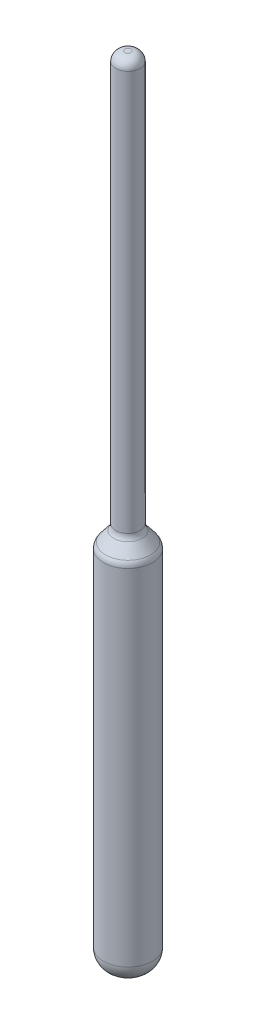
from build123d import *

# Parameters (mm, degrees)
FILLET1_R = 3
FILLET2_R = 3
FILLET3_R = 3
FILLET4_R = 6


with BuildPart() as part:
    # Sketch1 → Revolve1 (revolve)
    with BuildSketch(Plane.XY, mode=Mode.PRIVATE) as revolve1_sk:
        Polygon((0, 0), (0, 260), (-4, 260), (-4, 125), (-8, 120), (-8, 0), align=None)
    revolve(revolve1_sk.sketch.rotate(Axis((0, 0, 0), (0, 1, 0)), 270), axis=Axis((0, 0, 0), (0, 1, 0)))

    # Fillet1
    fillet1_edges = [part.edges().sort_by_distance(p)[0] for p in [
        (0, 260, 4),
    ]]
    fillet(fillet1_edges, radius=FILLET1_R)

    # Fillet2
    fillet2_edges = [part.edges().sort_by_distance(p)[0] for p in [
        (0, 120, 8),
    ]]
    fillet(fillet2_edges, radius=FILLET2_R)

    # Fillet3
    fillet3_edges = [part.edges().sort_by_distance(p)[0] for p in [
        (0, 125, 4),
    ]]
    fillet(fillet3_edges, radius=FILLET3_R)

    # Fillet4
    fillet4_edges = [part.edges().sort_by_distance(p)[0] for p in [
        (0, 0, 8),
    ]]
    fillet(fillet4_edges, radius=FILLET4_R)


solid = part.part
